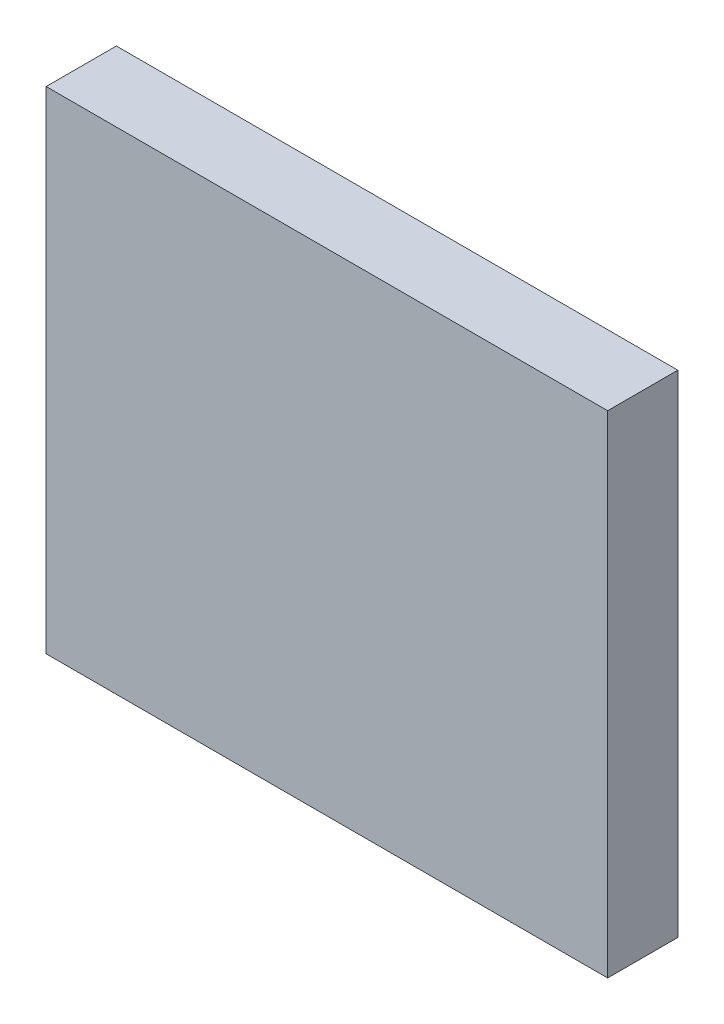
from build123d import *

# Parameters (mm, degrees)
ESQUISSE1_W        = 40
ESQUISSE1_H        = 35
BOSS_EXTRU_1_DEPTH = 5


with BuildPart() as part:
    # Esquisse1 → Boss.-Extru.1 (new body)
    with BuildSketch(Plane.XY):
        with Locations((20, 17.5)):
            Rectangle(ESQUISSE1_W, ESQUISSE1_H)
    extrude(amount=BOSS_EXTRU_1_DEPTH)


solid = part.part
